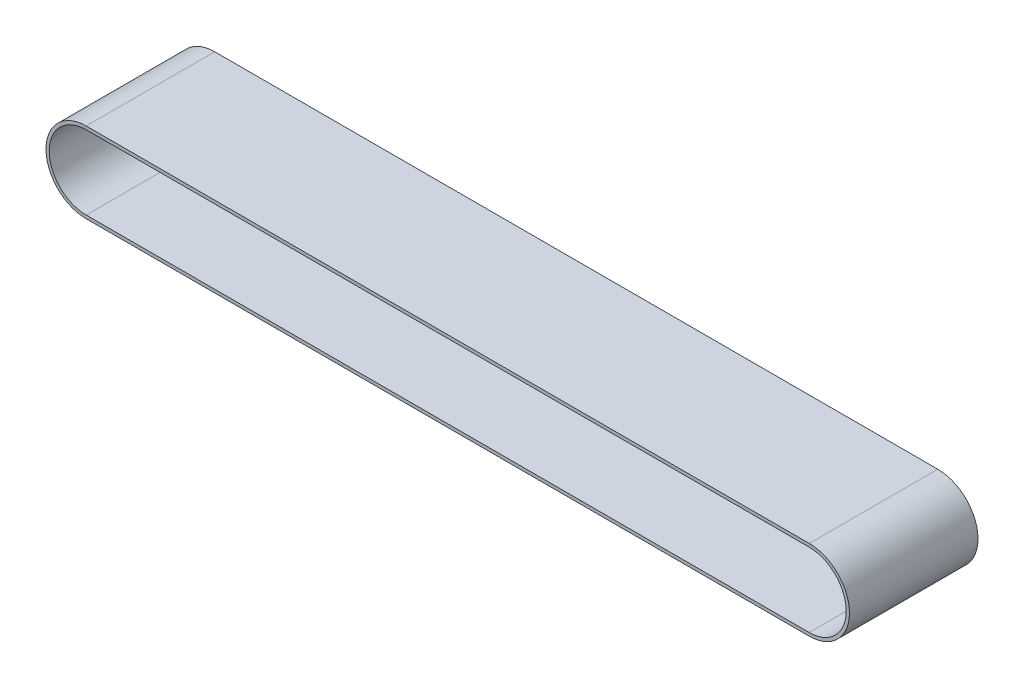
from build123d import *

# Parameters (mm, degrees)
AUFSATZ_LINEAR_START            = -9.5
AUFSATZ_LINEAR_AUSTRAGEN1_DEPTH = 80


with BuildPart() as part:
    # Skizze1 → Aufsatz-Linear austragen1 (new body)
    with BuildSketch(Plane.XY.offset(AUFSATZ_LINEAR_START)):
        with BuildLine():
            Line((0, 25), (435, 25))
            Line((435, 25), (450, 25))
            ThreePointArc((450, 25), (475, 0), (450, -25))
            Line((450, -25), (0, -25))
            ThreePointArc((0, -25), (-25, 0), (0, 25))
        make_face()
        with BuildLine():
            Line((0, 23), (435, 23))
            Line((435, 23), (450, 23))
            ThreePointArc((450, 23), (473, 0), (450, -23))
            Line((450, -23), (0, -23))
            ThreePointArc((0, -23), (-23, 0), (0, 23))
        make_face(mode=Mode.SUBTRACT)
    extrude(amount=-AUFSATZ_LINEAR_AUSTRAGEN1_DEPTH)


solid = part.part
